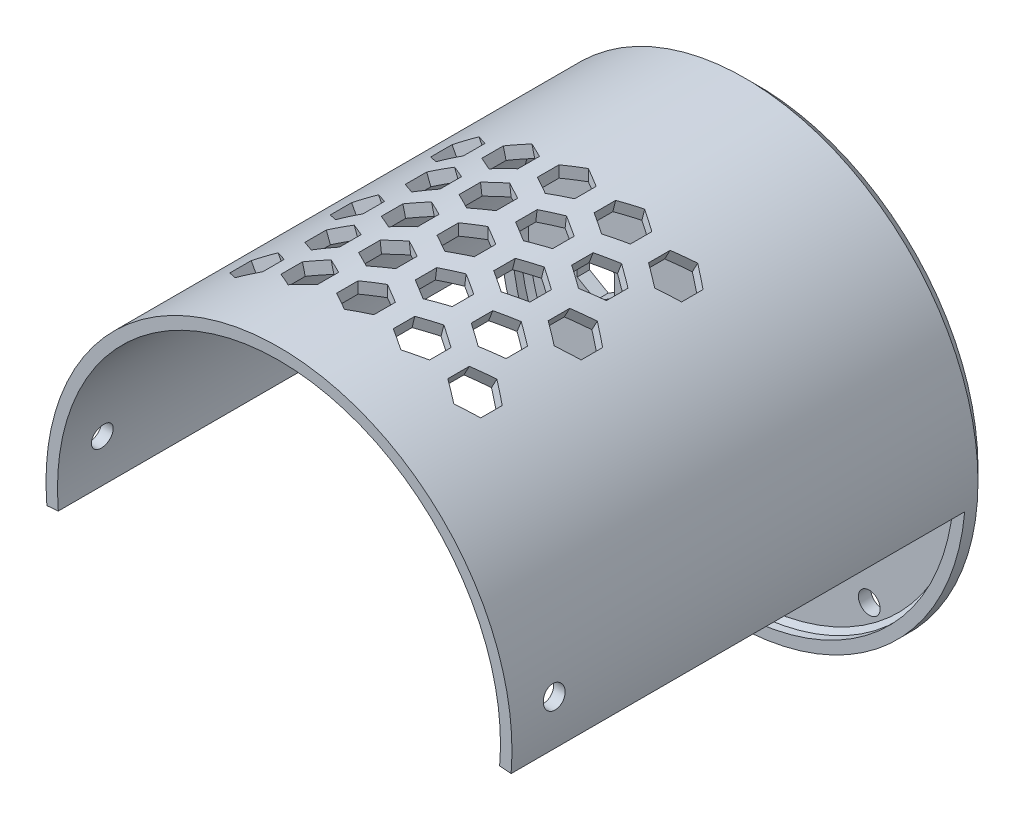
from build123d import *
from build123d.topology import SkipClean

# Parameters (mm, degrees)
SKETCH_1_R               = 37.5
EXTRUDE_1_DEPTH          = 4
EXTRUDE_2_DEPTH          = 73
CHAMFER_1_SIZE           = 2
CUT_EXTRUDE_START        = -2
SKETCH_3_R               = 35.65
CUT_EXTRUDE_1_DEPTH      = 2
CHAMFER_2_SIZE           = 0.75
CUT_EXTRUDE_2_DEPTH      = 94.495989219
CUT_EXTRUDE_2_DEPTH_BACK = 94.495989219
SKETCH_4_R               = 1.75
CUT_EXTRUDE_3_REACH      = 95.496
SKETCH_5_R               = 1.75
CUT_EXTRUDE_4_REACH      = 95.496
CUT_EXTRUDE_5_REACH      = 95.496
CUT_EXTRUDE_5_END_RADIUS = 37.5
PATTERN_CIRCULAR_1_COUNT = 3
PATTERN_CIRCULAR_1_ANGLE = 28
PATTERN_CIRCULAR_2_COUNT = 3
PATTERN_CIRCULAR_2_ANGLE = 28
CUT_EXTRUDE_6_REACH      = 95.496
CUT_EXTRUDE_6_END_RADIUS = 37.5
PATTERN_CIRCULAR_3_COUNT = 3
PATTERN_CIRCULAR_3_ANGLE = 28
PATTERN_CIRCULAR_4_COUNT = 2
PATTERN_CIRCULAR_4_ANGLE = 14


with BuildPart() as part:
    # Эскиз1 → Бобышка-Вытянуть1 (new body)
    with BuildSketch(Plane.XY):
        Circle(SKETCH_1_R)
    extrude(amount=EXTRUDE_1_DEPTH)

    # Эскиз2 → Бобышка-Вытянуть2 (add)
    with SkipClean():  # the faces are left unmerged after this step: merging them gives an invalid solid
        with BuildSketch(Plane.XY.offset(4)):
            with BuildLine():
                Line((-35.514340987, -3.107102229), (-37.357301178, -3.268340353))
                ThreePointArc((-37.357301178, -3.268340353), (0, 37.5), (37.357301178, -3.268340353))
                Line((37.357301178, -3.268340353), (35.514340987, -3.107102229))
                ThreePointArc((35.514340987, -3.107102229), (0, 35.65), (-35.514340987, -3.107102229))
            make_face()
        extrude(amount=EXTRUDE_2_DEPTH)

    # Фаска1
    chamfer_1_edges = [part.edges().sort_by_distance(p)[0] for p in [
        (-37.5, 0, 0),
    ]]
    chamfer(chamfer_1_edges, length=CHAMFER_1_SIZE)

    # Эскиз3 → Вырез-Вытянуть1 (cut)
    with SkipClean():  # the faces are left unmerged after this step: merging them gives an invalid solid
        with BuildSketch(Plane.XY.offset(4).offset(CUT_EXTRUDE_START)):
            with Locations(Location((0, 0, 0), (0, 0, 185))):
                Circle(SKETCH_3_R)
        extrude(amount=CUT_EXTRUDE_1_DEPTH, mode=Mode.SUBTRACT)

    # Фаска2
    chamfer_2_edges = [part.edges().sort_by_distance(p)[0] for p in [
        (35.514340987, 3.107102229, 2),
    ]]
    chamfer(chamfer_2_edges, length=CHAMFER_2_SIZE)

    # Эскиз4 → Вырез-Вытянуть2 (cut, two sides: drawn at the far end of the back side and taken through both)
    with SkipClean():  # the faces are left unmerged after this step: merging them gives an invalid solid
        with BuildSketch(Plane(origin=(0, 0, 0), x_dir=(0, 0, -1), z_dir=(1, 0, 0)).offset(-CUT_EXTRUDE_2_DEPTH_BACK)):
            with Locations((-70, 3.892897771)):
                Circle(SKETCH_4_R)
        extrude(amount=CUT_EXTRUDE_2_DEPTH + CUT_EXTRUDE_2_DEPTH_BACK, mode=Mode.SUBTRACT)

    # Эскиз5 → Вырез-Вытянуть3 (cut, up to next)
    with BuildSketch(Plane(origin=(0, 0, 0), x_dir=(-1, 0, 0), z_dir=(0, 0, -1)), mode=Mode.PRIVATE) as cut_extrude_3_sk1:
        with Locations((-20, -25.617376915)):
            Circle(SKETCH_5_R)
    cut_extrude_3_tool1 = extrude(cut_extrude_3_sk1.sketch, amount=-CUT_EXTRUDE_3_REACH, mode=Mode.PRIVATE) & part.part
    # Эскиз5 → Вырез-Вытянуть3 (cut, up to next)
    with BuildSketch(Plane(origin=(0, 0, 0), x_dir=(-1, 0, 0), z_dir=(0, 0, -1)), mode=Mode.PRIVATE) as cut_extrude_3_sk2:
        with Locations((20, -25.617376915)):
            Circle(SKETCH_5_R)
    cut_extrude_3_tool2 = extrude(cut_extrude_3_sk2.sketch, amount=-CUT_EXTRUDE_3_REACH, mode=Mode.PRIVATE) & part.part
    add(cut_extrude_3_tool1.solids().sort_by_distance((20, -25.617377, 0))[0], mode=Mode.SUBTRACT)
    add(cut_extrude_3_tool2.solids().sort_by_distance((-20, -25.617377, 0))[0], mode=Mode.SUBTRACT)

    # Эскиз6 → Вырез-Вытянуть4 (cut, up to next)
    with BuildSketch(Plane(origin=(0, 0, 0), x_dir=(-1, 0, 0), z_dir=(0, 0, -1)), mode=Mode.PRIVATE) as cut_extrude_4_sk1:
        Polygon((-16, -5.464101615), (-13, -3.732050808), (-13, -0.267949192), (-16, 1.464101615), (-19, -0.267949192), (-19, -3.732050808), align=None)
    cut_extrude_4_tool1 = extrude(cut_extrude_4_sk1.sketch, amount=-CUT_EXTRUDE_4_REACH, mode=Mode.PRIVATE) & part.part
    # Эскиз6 → Вырез-Вытянуть4 (cut, up to next)
    with BuildSketch(Plane(origin=(0, 0, 0), x_dir=(-1, 0, 0), z_dir=(0, 0, -1)), mode=Mode.PRIVATE) as cut_extrude_4_sk2:
        Polygon((-24, -5.464101615), (-21, -3.732050808), (-21, -0.267949192), (-24, 1.464101615), (-27, -0.267949192), (-27, -3.732050808), align=None)
    cut_extrude_4_tool2 = extrude(cut_extrude_4_sk2.sketch, amount=-CUT_EXTRUDE_4_REACH, mode=Mode.PRIVATE) & part.part
    # Эскиз6 → Вырез-Вытянуть4 (cut, up to next)
    with BuildSketch(Plane(origin=(0, 0, 0), x_dir=(-1, 0, 0), z_dir=(0, 0, -1)), mode=Mode.PRIVATE) as cut_extrude_4_sk3:
        Polygon((-8, -5.464101615), (-5, -3.732050808), (-5, -0.267949192), (-8, 1.464101615), (-11, -0.267949192), (-11, -3.732050808), align=None)
    cut_extrude_4_tool3 = extrude(cut_extrude_4_sk3.sketch, amount=-CUT_EXTRUDE_4_REACH, mode=Mode.PRIVATE) & part.part
    # Эскиз6 → Вырез-Вытянуть4 (cut, up to next)
    with BuildSketch(Plane(origin=(0, 0, 0), x_dir=(-1, 0, 0), z_dir=(0, 0, -1)), mode=Mode.PRIVATE) as cut_extrude_4_sk4:
        Polygon((0, -5.464101615), (3, -3.732050808), (3, -0.267949192), (0, 1.464101615), (-3, -0.267949192), (-3, -3.732050808), align=None)
    cut_extrude_4_tool4 = extrude(cut_extrude_4_sk4.sketch, amount=-CUT_EXTRUDE_4_REACH, mode=Mode.PRIVATE) & part.part
    # Эскиз6 → Вырез-Вытянуть4 (cut, up to next)
    with BuildSketch(Plane(origin=(0, 0, 0), x_dir=(-1, 0, 0), z_dir=(0, 0, -1)), mode=Mode.PRIVATE) as cut_extrude_4_sk5:
        Polygon((8, -5.464101615), (11, -3.732050808), (11, -0.267949192), (8, 1.464101615), (5, -0.267949192), (5, -3.732050808), align=None)
    cut_extrude_4_tool5 = extrude(cut_extrude_4_sk5.sketch, amount=-CUT_EXTRUDE_4_REACH, mode=Mode.PRIVATE) & part.part
    # Эскиз6 → Вырез-Вытянуть4 (cut, up to next)
    with BuildSketch(Plane(origin=(0, 0, 0), x_dir=(-1, 0, 0), z_dir=(0, 0, -1)), mode=Mode.PRIVATE) as cut_extrude_4_sk6:
        Polygon((16, -5.464101615), (19, -3.732050808), (19, -0.267949192), (16, 1.464101615), (13, -0.267949192), (13, -3.732050808), align=None)
    cut_extrude_4_tool6 = extrude(cut_extrude_4_sk6.sketch, amount=-CUT_EXTRUDE_4_REACH, mode=Mode.PRIVATE) & part.part
    # Эскиз6 → Вырез-Вытянуть4 (cut, up to next)
    with BuildSketch(Plane(origin=(0, 0, 0), x_dir=(-1, 0, 0), z_dir=(0, 0, -1)), mode=Mode.PRIVATE) as cut_extrude_4_sk7:
        Polygon((24, -5.464101615), (27, -3.732050808), (27, -0.267949192), (24, 1.464101615), (21, -0.267949192), (21, -3.732050808), align=None)
    cut_extrude_4_tool7 = extrude(cut_extrude_4_sk7.sketch, amount=-CUT_EXTRUDE_4_REACH, mode=Mode.PRIVATE) & part.part
    # Эскиз6 → Вырез-Вытянуть4 (cut, up to next)
    with BuildSketch(Plane(origin=(0, 0, 0), x_dir=(-1, 0, 0), z_dir=(0, 0, -1)), mode=Mode.PRIVATE) as cut_extrude_4_sk8:
        Polygon((-16, -21.624101615), (-13, -19.892050808), (-13, -16.427949192), (-16, -14.695898385), (-19, -16.427949192), (-19, -19.892050808), align=None)
    cut_extrude_4_tool8 = extrude(cut_extrude_4_sk8.sketch, amount=-CUT_EXTRUDE_4_REACH, mode=Mode.PRIVATE) & part.part
    # Эскиз6 → Вырез-Вытянуть4 (cut, up to next)
    with BuildSketch(Plane(origin=(0, 0, 0), x_dir=(-1, 0, 0), z_dir=(0, 0, -1)), mode=Mode.PRIVATE) as cut_extrude_4_sk9:
        Polygon((-8, -21.624101615), (-5, -19.892050808), (-5, -16.427949192), (-8, -14.695898385), (-11, -16.427949192), (-11, -19.892050808), align=None)
    cut_extrude_4_tool9 = extrude(cut_extrude_4_sk9.sketch, amount=-CUT_EXTRUDE_4_REACH, mode=Mode.PRIVATE) & part.part
    # Эскиз6 → Вырез-Вытянуть4 (cut, up to next)
    with BuildSketch(Plane(origin=(0, 0, 0), x_dir=(-1, 0, 0), z_dir=(0, 0, -1)), mode=Mode.PRIVATE) as cut_extrude_4_sk10:
        Polygon((0, -21.624101615), (3, -19.892050808), (3, -16.427949192), (0, -14.695898385), (-3, -16.427949192), (-3, -19.892050808), align=None)
    cut_extrude_4_tool10 = extrude(cut_extrude_4_sk10.sketch, amount=-CUT_EXTRUDE_4_REACH, mode=Mode.PRIVATE) & part.part
    # Эскиз6 → Вырез-Вытянуть4 (cut, up to next)
    with BuildSketch(Plane(origin=(0, 0, 0), x_dir=(-1, 0, 0), z_dir=(0, 0, -1)), mode=Mode.PRIVATE) as cut_extrude_4_sk11:
        Polygon((8, -21.624101615), (11, -19.892050808), (11, -16.427949192), (8, -14.695898385), (5, -16.427949192), (5, -19.892050808), align=None)
    cut_extrude_4_tool11 = extrude(cut_extrude_4_sk11.sketch, amount=-CUT_EXTRUDE_4_REACH, mode=Mode.PRIVATE) & part.part
    # Эскиз6 → Вырез-Вытянуть4 (cut, up to next)
    with BuildSketch(Plane(origin=(0, 0, 0), x_dir=(-1, 0, 0), z_dir=(0, 0, -1)), mode=Mode.PRIVATE) as cut_extrude_4_sk12:
        Polygon((16, -21.624101615), (19, -19.892050808), (19, -16.427949192), (16, -14.695898385), (13, -16.427949192), (13, -19.892050808), align=None)
    cut_extrude_4_tool12 = extrude(cut_extrude_4_sk12.sketch, amount=-CUT_EXTRUDE_4_REACH, mode=Mode.PRIVATE) & part.part
    # Эскиз6 → Вырез-Вытянуть4 (cut, up to next)
    with BuildSketch(Plane(origin=(0, 0, 0), x_dir=(-1, 0, 0), z_dir=(0, 0, -1)), mode=Mode.PRIVATE) as cut_extrude_4_sk13:
        Polygon((-20, -13.547005384), (-17, -11.814954576), (-17, -8.350852961), (-20, -6.618802154), (-23, -8.350852961), (-23, -11.814954576), align=None)
    cut_extrude_4_tool13 = extrude(cut_extrude_4_sk13.sketch, amount=-CUT_EXTRUDE_4_REACH, mode=Mode.PRIVATE) & part.part
    # Эскиз6 → Вырез-Вытянуть4 (cut, up to next)
    with BuildSketch(Plane(origin=(0, 0, 0), x_dir=(-1, 0, 0), z_dir=(0, 0, -1)), mode=Mode.PRIVATE) as cut_extrude_4_sk14:
        Polygon((-12, -13.547005384), (-9, -11.814954576), (-9, -8.350852961), (-12, -6.618802154), (-15, -8.350852961), (-15, -11.814954576), align=None)
    cut_extrude_4_tool14 = extrude(cut_extrude_4_sk14.sketch, amount=-CUT_EXTRUDE_4_REACH, mode=Mode.PRIVATE) & part.part
    # Эскиз6 → Вырез-Вытянуть4 (cut, up to next)
    with BuildSketch(Plane(origin=(0, 0, 0), x_dir=(-1, 0, 0), z_dir=(0, 0, -1)), mode=Mode.PRIVATE) as cut_extrude_4_sk15:
        Polygon((-4, -13.547005384), (-1, -11.814954576), (-1, -8.350852961), (-4, -6.618802154), (-7, -8.350852961), (-7, -11.814954576), align=None)
    cut_extrude_4_tool15 = extrude(cut_extrude_4_sk15.sketch, amount=-CUT_EXTRUDE_4_REACH, mode=Mode.PRIVATE) & part.part
    # Эскиз6 → Вырез-Вытянуть4 (cut, up to next)
    with BuildSketch(Plane(origin=(0, 0, 0), x_dir=(-1, 0, 0), z_dir=(0, 0, -1)), mode=Mode.PRIVATE) as cut_extrude_4_sk16:
        Polygon((4, -13.547005384), (7, -11.814954576), (7, -8.350852961), (4, -6.618802154), (1, -8.350852961), (1, -11.814954576), align=None)
    cut_extrude_4_tool16 = extrude(cut_extrude_4_sk16.sketch, amount=-CUT_EXTRUDE_4_REACH, mode=Mode.PRIVATE) & part.part
    # Эскиз6 → Вырез-Вытянуть4 (cut, up to next)
    with BuildSketch(Plane(origin=(0, 0, 0), x_dir=(-1, 0, 0), z_dir=(0, 0, -1)), mode=Mode.PRIVATE) as cut_extrude_4_sk17:
        Polygon((12, -13.547005384), (15, -11.814954576), (15, -8.350852961), (12, -6.618802154), (9, -8.350852961), (9, -11.814954576), align=None)
    cut_extrude_4_tool17 = extrude(cut_extrude_4_sk17.sketch, amount=-CUT_EXTRUDE_4_REACH, mode=Mode.PRIVATE) & part.part
    # Эскиз6 → Вырез-Вытянуть4 (cut, up to next)
    with BuildSketch(Plane(origin=(0, 0, 0), x_dir=(-1, 0, 0), z_dir=(0, 0, -1)), mode=Mode.PRIVATE) as cut_extrude_4_sk18:
        Polygon((20, -13.547005384), (23, -11.814954576), (23, -8.350852961), (20, -6.618802154), (17, -8.350852961), (17, -11.814954576), align=None)
    cut_extrude_4_tool18 = extrude(cut_extrude_4_sk18.sketch, amount=-CUT_EXTRUDE_4_REACH, mode=Mode.PRIVATE) & part.part
    # Эскиз6 → Вырез-Вытянуть4 (cut, up to next)
    with BuildSketch(Plane(origin=(0, 0, 0), x_dir=(-1, 0, 0), z_dir=(0, 0, -1)), mode=Mode.PRIVATE) as cut_extrude_4_sk19:
        Polygon((-4, -29.707005384), (-1, -27.974954576), (-1, -24.510852961), (-4, -22.778802154), (-7, -24.510852961), (-7, -27.974954576), align=None)
    cut_extrude_4_tool19 = extrude(cut_extrude_4_sk19.sketch, amount=-CUT_EXTRUDE_4_REACH, mode=Mode.PRIVATE) & part.part
    # Эскиз6 → Вырез-Вытянуть4 (cut, up to next)
    with BuildSketch(Plane(origin=(0, 0, 0), x_dir=(-1, 0, 0), z_dir=(0, 0, -1)), mode=Mode.PRIVATE) as cut_extrude_4_sk20:
        Polygon((4, -29.707005384), (7, -27.974954576), (7, -24.510852961), (4, -22.778802154), (1, -24.510852961), (1, -27.974954576), align=None)
    cut_extrude_4_tool20 = extrude(cut_extrude_4_sk20.sketch, amount=-CUT_EXTRUDE_4_REACH, mode=Mode.PRIVATE) & part.part
    add(cut_extrude_4_tool1.solids().sort_by_distance((16, -2, 0))[0], mode=Mode.SUBTRACT)
    add(cut_extrude_4_tool2.solids().sort_by_distance((24, -2, 0))[0], mode=Mode.SUBTRACT)
    add(cut_extrude_4_tool3.solids().sort_by_distance((8, -2, 0))[0], mode=Mode.SUBTRACT)
    add(cut_extrude_4_tool4.solids().sort_by_distance((0, -2, 0))[0], mode=Mode.SUBTRACT)
    add(cut_extrude_4_tool5.solids().sort_by_distance((-8, -2, 0))[0], mode=Mode.SUBTRACT)
    add(cut_extrude_4_tool6.solids().sort_by_distance((-16, -2, 0))[0], mode=Mode.SUBTRACT)
    add(cut_extrude_4_tool7.solids().sort_by_distance((-24, -2, 0))[0], mode=Mode.SUBTRACT)
    add(cut_extrude_4_tool8.solids().sort_by_distance((16, -18.16, 0))[0], mode=Mode.SUBTRACT)
    add(cut_extrude_4_tool9.solids().sort_by_distance((8, -18.16, 0))[0], mode=Mode.SUBTRACT)
    add(cut_extrude_4_tool10.solids().sort_by_distance((0, -18.16, 0))[0], mode=Mode.SUBTRACT)
    add(cut_extrude_4_tool11.solids().sort_by_distance((-8, -18.16, 0))[0], mode=Mode.SUBTRACT)
    add(cut_extrude_4_tool12.solids().sort_by_distance((-16, -18.16, 0))[0], mode=Mode.SUBTRACT)
    add(cut_extrude_4_tool13.solids().sort_by_distance((20, -10.082904, 0))[0], mode=Mode.SUBTRACT)
    add(cut_extrude_4_tool14.solids().sort_by_distance((12, -10.082904, 0))[0], mode=Mode.SUBTRACT)
    add(cut_extrude_4_tool15.solids().sort_by_distance((4, -10.082904, 0))[0], mode=Mode.SUBTRACT)
    add(cut_extrude_4_tool16.solids().sort_by_distance((-4, -10.082904, 0))[0], mode=Mode.SUBTRACT)
    add(cut_extrude_4_tool17.solids().sort_by_distance((-12, -10.082904, 0))[0], mode=Mode.SUBTRACT)
    add(cut_extrude_4_tool18.solids().sort_by_distance((-20, -10.082904, 0))[0], mode=Mode.SUBTRACT)
    add(cut_extrude_4_tool19.solids().sort_by_distance((4, -26.242904, 0))[0], mode=Mode.SUBTRACT)
    add(cut_extrude_4_tool20.solids().sort_by_distance((-4, -26.242904, 0))[0], mode=Mode.SUBTRACT)

    # Вырез-Вытянуть5: up to this cylinder (the profile starts inside it)
    with SkipClean():  # the faces are left unmerged after this step: merging them gives an invalid solid
        cut_extrude_5_end = Plane(origin=(0, 0, 46.84), z_dir=(0, 0, -1)) * Cylinder(CUT_EXTRUDE_5_END_RADIUS, 299.312, mode=Mode.PRIVATE)
        # Эскиз7 → Вырез-Вытянуть5 (cut, up to the surface)
        with BuildSketch(Plane(origin=(0, 0, 0), x_dir=(1, 0, 0), z_dir=(0, 1, 0)), mode=Mode.PRIVATE) as cut_extrude_5_sk1:
            Polygon((0, -66.464101615), (3, -64.732050808), (3, -61.267949192), (0, -59.535898385), (-3, -61.267949192), (-3, -64.732050808), align=None)
        cut_extrude_5_tool1 = extrude(cut_extrude_5_sk1.sketch, amount=CUT_EXTRUDE_5_REACH, mode=Mode.PRIVATE) & cut_extrude_5_end
        # Эскиз7 → Вырез-Вытянуть5 (cut, up to the surface)
        with BuildSketch(Plane(origin=(0, 0, 0), x_dir=(1, 0, 0), z_dir=(0, 1, 0)), mode=Mode.PRIVATE) as cut_extrude_5_sk2:
            Polygon((0, -50.304101615), (3, -48.572050808), (3, -45.107949192), (0, -43.375898385), (-3, -45.107949192), (-3, -48.572050808), align=None)
        cut_extrude_5_tool2 = extrude(cut_extrude_5_sk2.sketch, amount=CUT_EXTRUDE_5_REACH, mode=Mode.PRIVATE) & cut_extrude_5_end
        # Эскиз7 → Вырез-Вытянуть5 (cut, up to the surface)
        with BuildSketch(Plane(origin=(0, 0, 0), x_dir=(1, 0, 0), z_dir=(0, 1, 0)), mode=Mode.PRIVATE) as cut_extrude_5_sk3:
            Polygon((0, -34.144101615), (3, -32.412050808), (3, -28.947949192), (0, -27.215898385), (-3, -28.947949192), (-3, -32.412050808), align=None)
        cut_extrude_5_tool3 = extrude(cut_extrude_5_sk3.sketch, amount=CUT_EXTRUDE_5_REACH, mode=Mode.PRIVATE) & cut_extrude_5_end
        cut_extrude_5 = cut_extrude_5_tool1.solids().sort_by_distance((0, 0, 63))[0] + cut_extrude_5_tool2.solids().sort_by_distance((0, 0, 46.84))[0] + cut_extrude_5_tool3.solids().sort_by_distance((0, 0, 30.68))[0]
        add(cut_extrude_5, mode=Mode.SUBTRACT)

    # Круговой массив1: Вырез-Вытянуть5 ×3 about axis
    with SkipClean():  # the faces are left unmerged after this step: merging them gives an invalid solid
        pattern_circular_1_axis = Axis((0, 0, 0), (0, 0, 1))
        for i in range(1, PATTERN_CIRCULAR_1_COUNT):
            add(cut_extrude_5.rotate(pattern_circular_1_axis, i * PATTERN_CIRCULAR_1_ANGLE / (PATTERN_CIRCULAR_1_COUNT - 1)), mode=Mode.SUBTRACT)

    # Круговой массив2: Вырез-Вытянуть5 ×3 about axis
    with SkipClean():  # the faces are left unmerged after this step: merging them gives an invalid solid
        pattern_circular_2_axis = Axis((0, 0, 0), (0, 0, -1))
        for i in range(1, PATTERN_CIRCULAR_2_COUNT):
            add(cut_extrude_5.rotate(pattern_circular_2_axis, i * PATTERN_CIRCULAR_2_ANGLE / (PATTERN_CIRCULAR_2_COUNT - 1)), mode=Mode.SUBTRACT)

    # Вырез-Вытянуть6: up to this cylinder (the profile starts inside it)
    with SkipClean():  # the faces are left unmerged after this step: merging them gives an invalid solid
        cut_extrude_6_end = Plane(origin=(0, 0, 46.84), z_dir=(0, 0, -1)) * Cylinder(CUT_EXTRUDE_6_END_RADIUS, 283.152, mode=Mode.PRIVATE)
        # Эскиз8 → Вырез-Вытянуть6 (cut, up to the surface)
        with BuildSketch(Plane(origin=(0, 0, 0), x_dir=(0, 0, -1), z_dir=(-0.12186934340514774, 0.992546151641322, 0)), mode=Mode.PRIVATE) as cut_extrude_6_sk1:
            Polygon((-42.224101615, 0), (-40.492050808, -3), (-37.027949192, -3), (-35.295898385, 0), (-37.027949192, 3), (-40.492050808, 3), align=None)
        cut_extrude_6_tool1 = extrude(cut_extrude_6_sk1.sketch, amount=CUT_EXTRUDE_6_REACH, mode=Mode.PRIVATE) & cut_extrude_6_end
        # Эскиз8 → Вырез-Вытянуть6 (cut, up to the surface)
        with BuildSketch(Plane(origin=(0, 0, 0), x_dir=(0, 0, -1), z_dir=(-0.12186934340514774, 0.992546151641322, 0)), mode=Mode.PRIVATE) as cut_extrude_6_sk2:
            Polygon((-58.384101615, 0), (-56.652050808, -3), (-53.187949192, -3), (-51.455898385, 0), (-53.187949192, 3), (-56.652050808, 3), align=None)
        cut_extrude_6_tool2 = extrude(cut_extrude_6_sk2.sketch, amount=CUT_EXTRUDE_6_REACH, mode=Mode.PRIVATE) & cut_extrude_6_end
        cut_extrude_6 = cut_extrude_6_tool1.solids().sort_by_distance((0, 0, 38.76))[0] + cut_extrude_6_tool2.solids().sort_by_distance((0, 0, 54.92))[0]
        add(cut_extrude_6, mode=Mode.SUBTRACT)

    # Круговой массив3: Вырез-Вытянуть6 ×3 about axis
    with SkipClean():  # the faces are left unmerged after this step: merging them gives an invalid solid
        pattern_circular_3_axis = Axis((0, 0, 0), (0, 0, -1))
        for i in range(1, PATTERN_CIRCULAR_3_COUNT):
            add(cut_extrude_6.rotate(pattern_circular_3_axis, i * PATTERN_CIRCULAR_3_ANGLE / (PATTERN_CIRCULAR_3_COUNT - 1)), mode=Mode.SUBTRACT)

    # Круговой массив4: Вырез-Вытянуть6 ×2 about axis
    with SkipClean():  # the faces are left unmerged after this step: merging them gives an invalid solid
        pattern_circular_4_axis = Axis((0, 0, 4), (0, 0, 1))
        for i in range(1, PATTERN_CIRCULAR_4_COUNT):
            add(cut_extrude_6.rotate(pattern_circular_4_axis, i * PATTERN_CIRCULAR_4_ANGLE / (PATTERN_CIRCULAR_4_COUNT - 1)), mode=Mode.SUBTRACT)


solid = part.part
